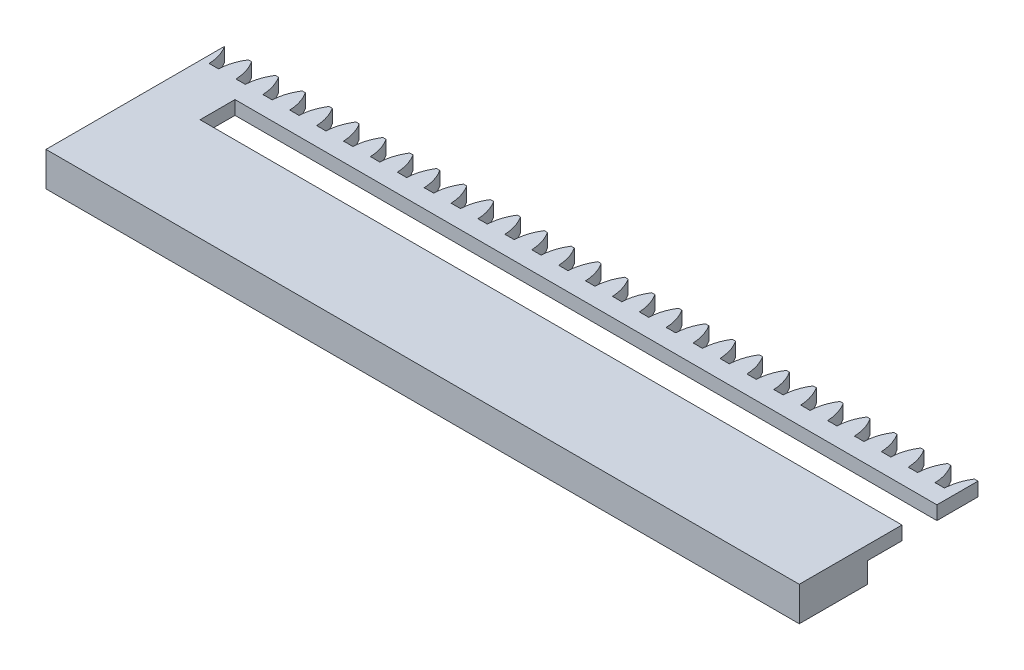
from build123d import *

# Parameters (mm, degrees)
BOSS_EXTRUDE1_DEPTH = 5.08
CUT_EXTRUDE1_DEPTH  = 155.095804696
LPATTERN1_COUNT     = 28
LPATTERN1_PITCH     = 9.974326
SKETCH4_W           = 279.4
SKETCH4_H           = 25.4
BOSS_EXTRUDE2_DEPTH = 7.62


with BuildPart() as part:
    # Sketch1 → Boss-Extrude1 (new body)
    with BuildSketch(Plane(origin=(0, 0, 0), x_dir=(1, 0, 0), z_dir=(0, 1, 0))):
        Polygon((-149.225, -38.1), (-149.225, 28.194), (130.175, 28.194), (130.175, 12.954), (-130.175, 12.954), (-130.175, 0), (130.175, 0), (130.175, -38.1), align=None)
    extrude(amount=BOSS_EXTRUDE1_DEPTH)

    # Sketch2 → Cut-Extrude1 (cut, through all)
    with BuildSketch(Plane(origin=(0, 5.08, 0), x_dir=(1, 0, 0), z_dir=(0, 1, 0))):
        with BuildLine():
            ThreePointArc((-146.56997683, 19.717013973), (-147.330155915, 24.13319761), (-149.225, 28.194))
            ThreePointArc((-149.225, 28.194), (-144.836574415, 28.369434802), (-140.448148829, 28.194))
            ThreePointArc((-140.448148829, 28.194), (-142.342992915, 24.13319761), (-143.103171999, 19.717013973))
            ThreePointArc((-143.103171999, 19.717013973), (-144.836574415, 19.749434802), (-146.56997683, 19.717013973))
        make_face()
    cut_extrude1 = extrude(amount=-CUT_EXTRUDE1_DEPTH, mode=Mode.SUBTRACT)

    # LPattern1: Cut-Extrude1 ×28
    with Locations(*[(i * LPATTERN1_PITCH, 0, 0) for i in range(1, LPATTERN1_COUNT)]):
        add(cut_extrude1, mode=Mode.SUBTRACT)

    # Sketch4 → Boss-Extrude2 (add)
    with BuildSketch(Plane.XZ):
        with Locations((-9.525, 25.4)):
            Rectangle(SKETCH4_W, SKETCH4_H)
    extrude(amount=BOSS_EXTRUDE2_DEPTH)


solid = part.part
